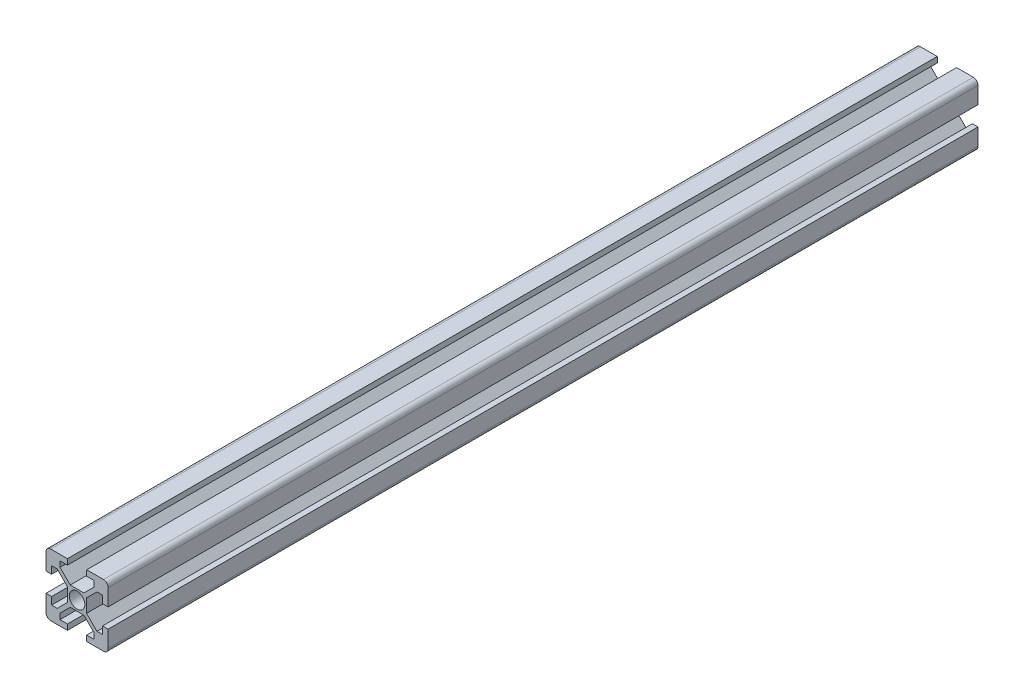
from build123d import *

# Parameters (mm, degrees)
SKETCH_1_R      = 2.5
EXTRUDE_1_DEPTH = 280


with BuildPart() as part:
    # 草图1 → 凸台-拉伸1 (new body)
    with BuildSketch(Plane.XY):
        with BuildLine():
            Line((-8.2, -3.1), (-10, -3.1))
            Line((-10, -3.1), (-10, -8.5))
            ThreePointArc((-10, -8.5), (-9.560660172, -9.560660172), (-8.5, -10))
            Line((-8.5, -10), (-3.1, -10))
            Line((-3.1, -10), (-3.1, -8.2))
            Line((-3.1, -8.2), (-5.5, -8.2))
            Line((-5.5, -8.2), (-5.5, -6.397050155))
            Line((-5.5, -6.397050155), (-2.202949845, -3.1))
            Line((-2.202949845, -3.1), (2.202949845, -3.1))
            Line((2.202949845, -3.1), (5.5, -6.397050155))
            Line((5.5, -6.397050155), (5.5, -8.2))
            Line((5.5, -8.2), (3.1, -8.2))
            Line((3.1, -8.2), (3.1, -10))
            Line((3.1, -10), (8.5, -10))
            ThreePointArc((8.5, -10), (9.560660172, -9.560660172), (10, -8.5))
            Line((10, -8.5), (10, -3.1))
            Line((10, -3.1), (8.2, -3.1))
            Line((8.2, -3.1), (8.2, -5.5))
            Line((8.2, -5.5), (6.397050155, -5.5))
            Line((6.397050155, -5.5), (3.05412702, -2.157076865))
            Line((3.05412702, -2.157076865), (3.05412702, 2.157076865))
            Line((3.05412702, 2.157076865), (6.397050155, 5.5))
            Line((6.397050155, 5.5), (8.2, 5.5))
            Line((8.2, 5.5), (8.2, 3.1))
            Line((8.2, 3.1), (10, 3.1))
            Line((10, 3.1), (10, 8.5))
            ThreePointArc((10, 8.5), (9.560660172, 9.560660172), (8.5, 10))
            Line((8.5, 10), (3.1, 10))
            Line((3.1, 10), (3.1, 8.2))
            Line((3.1, 8.2), (5.5, 8.2))
            Line((5.5, 8.2), (5.5, 6.397050155))
            Line((5.5, 6.397050155), (2.202949845, 3.1))
            Line((2.202949845, 3.1), (-2.202949845, 3.1))
            Line((-2.202949845, 3.1), (-5.5, 6.397050155))
            Line((-5.5, 6.397050155), (-5.5, 8.2))
            Line((-5.5, 8.2), (-3.1, 8.2))
            Line((-3.1, 8.2), (-3.1, 10))
            Line((-3.1, 10), (-8.5, 10))
            ThreePointArc((-8.5, 10), (-9.560660172, 9.560660172), (-10, 8.5))
            Line((-10, 8.5), (-10, 3.1))
            Line((-10, 3.1), (-8.2, 3.1))
            Line((-8.2, 3.1), (-8.2, 5.5))
            Line((-8.2, 5.5), (-6.397050155, 5.5))
            Line((-6.397050155, 5.5), (-3.05412702, 2.157076865))
            Line((-3.05412702, 2.157076865), (-3.05412702, -2.157076865))
            Line((-3.05412702, -2.157076865), (-6.397050155, -5.5))
            Line((-6.397050155, -5.5), (-8.2, -5.5))
            Line((-8.2, -5.5), (-8.2, -3.1))
        make_face()
        Circle(SKETCH_1_R, mode=Mode.SUBTRACT)
    extrude(amount=EXTRUDE_1_DEPTH)


solid = part.part
